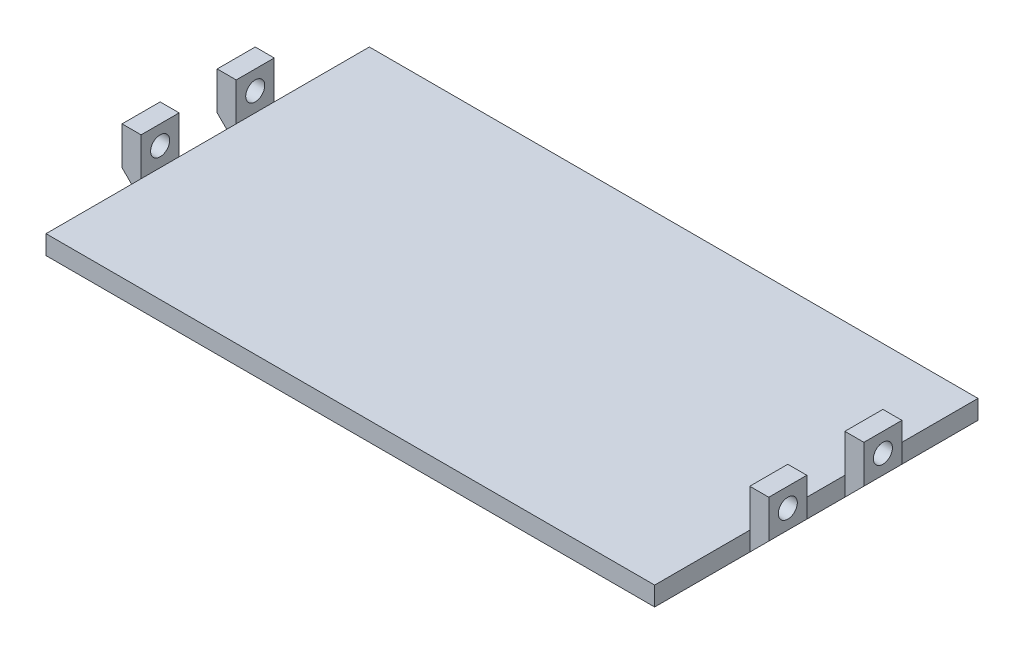
from build123d import *

# Parameters (mm, degrees)
SKETCH1_W           = 170
SKETCH1_H           = 85
BOSS_EXTRUDE1_DEPTH = 5
SKETCH2_W           = 5
SKETCH2_H           = 10
BOSS_EXTRUDE2_DEPTH = 10
SKETCH3_R           = 2.5
CUT_EXTRUDE1_DEPTH  = 176.87282337
SKETCH4_W           = 5
SKETCH4_H           = 25
SKETCH4_H_2         = 15
CUT_EXTRUDE2_DEPTH  = 96.557574268
CHAMFER1_SIZE       = 5


with BuildPart() as part:
    # Sketch1 → Boss-Extrude1 (new body)
    with BuildSketch(Plane(origin=(0, 0, 0), x_dir=(1, 0, 0), z_dir=(0, 1, 0))):
        Rectangle(SKETCH1_W, SKETCH1_H)
    extrude(amount=BOSS_EXTRUDE1_DEPTH)

    # Sketch2 → Boss-Extrude2 (add)
    with BuildSketch(Plane(origin=(0, 5, 0), x_dir=(1, 0, 0), z_dir=(0, 1, 0))):
        with Locations((-82.5, 12.5)):
            Rectangle(SKETCH2_W, SKETCH2_H)
        with Locations((-82.5, -12.5)):
            Rectangle(SKETCH2_W, SKETCH2_H)
        with Locations((82.5, -12.5)):
            Rectangle(SKETCH2_W, SKETCH2_H)
        with Locations((82.5, 12.5)):
            Rectangle(SKETCH2_W, SKETCH2_H)
    extrude(amount=BOSS_EXTRUDE2_DEPTH)

    # Sketch3 → Cut-Extrude1 (cut, through all)
    with BuildSketch(Plane.ZY.offset(85)):
        with Locations((-12.5, 10)):
            Circle(SKETCH3_R)
        with Locations((12.5, 10)):
            Circle(SKETCH3_R)
    extrude(amount=-CUT_EXTRUDE1_DEPTH, mode=Mode.SUBTRACT)

    # Sketch4 → Cut-Extrude2 (cut, through all)
    with BuildSketch(Plane(origin=(0, 5, 0), x_dir=(1, 0, 0), z_dir=(0, 1, 0))):
        with Locations((-82.5, 30)):
            Rectangle(SKETCH4_W, SKETCH4_H)
        with Locations((-82.5, -30)):
            Rectangle(SKETCH4_W, SKETCH4_H)
        with Locations((-82.5, 0)):
            Rectangle(SKETCH4_W, SKETCH4_H_2)
        with Locations((82.5, 0)):
            Rectangle(SKETCH4_W, SKETCH4_H_2)
        with Locations((82.5, 30)):
            Rectangle(SKETCH4_W, SKETCH4_H)
        with Locations((82.5, -30)):
            Rectangle(SKETCH4_W, SKETCH4_H)
    extrude(amount=-CUT_EXTRUDE2_DEPTH, mode=Mode.SUBTRACT)

    # Chamfer1
    chamfer1_edges = [part.edges().sort_by_distance(p)[0] for p in [
        (85, 0, 12.5),
        (85, 0, -12.5),
        (-85, 0, 12.5),
        (-85, 0, -12.5),
    ]]
    chamfer(chamfer1_edges, length=CHAMFER1_SIZE)


solid = part.part
